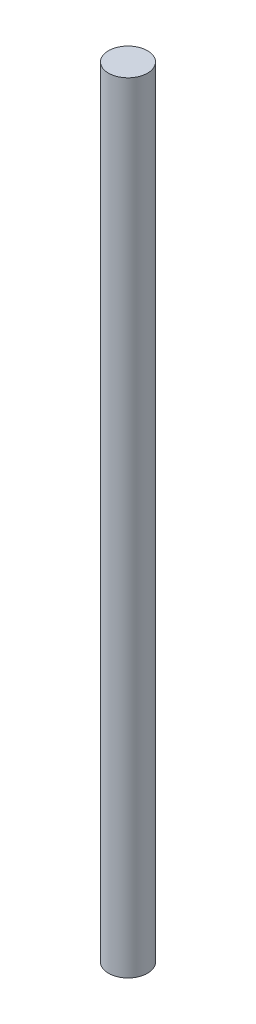
from build123d import *

# Parameters (mm, degrees)
SKETCH_1_R      = 1
EXTRUDE_1_DEPTH = 40


with BuildPart() as part:
    # 草图1 → 凸台-拉伸1 (new body)
    with BuildSketch(Plane(origin=(0, 0, 0), x_dir=(1, 0, 0), z_dir=(0, 1, 0))):
        with Locations(Location((0, 0, 0), (0, 0, 270))):
            Circle(SKETCH_1_R)
    extrude(amount=EXTRUDE_1_DEPTH)


solid = part.part
